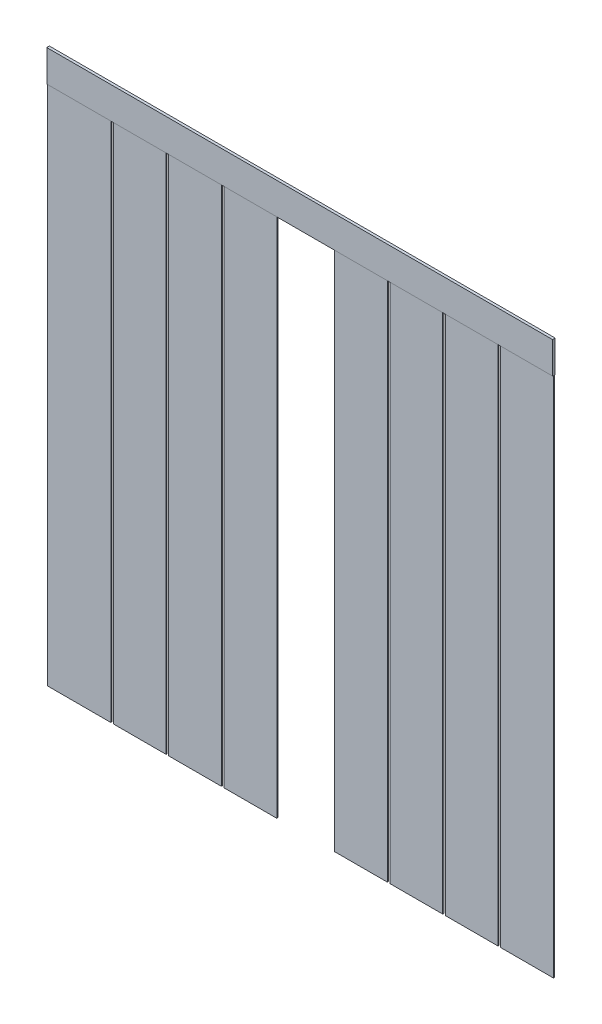
from build123d import *

# Parameters (mm, degrees)
CROQUIS1_W              = 1920
CROQUIS1_H              = 2100
SALIENTE_EXTRUIR1_DEPTH = 10
CROQUIS2_W              = 1920
CROQUIS2_H              = 1980
CORTAR_EXTRUIR1_DEPTH   = 3
CROQUIS3_W              = 1920
CROQUIS3_H              = 1980
CORTAR_EXTRUIR2_DEPTH   = 3
CROQUIS4_W              = 10
CROQUIS4_H              = 1980
CORTAR_EXTRUIR3_DEPTH   = 8
MATRIZL1_COUNT          = 8
MATRIZL1_PITCH          = 210
CROQUIS5_W              = 200
CROQUIS5_H              = 1980
CORTAR_EXTRUIR4_DEPTH   = 10


with BuildPart() as part:
    # Croquis1 → Saliente-Extruir1 (new body)
    with BuildSketch(Plane.XY):
        with Locations((960, -1050)):
            Rectangle(CROQUIS1_W, CROQUIS1_H)
    extrude(amount=SALIENTE_EXTRUIR1_DEPTH)

    # Croquis2 → Cortar-Extruir1 (cut)
    with BuildSketch(Plane.XY.offset(10)):
        with Locations((960, -1110)):
            Rectangle(CROQUIS2_W, CROQUIS2_H)
    extrude(amount=-CORTAR_EXTRUIR1_DEPTH, mode=Mode.SUBTRACT)

    # Croquis3 → Cortar-Extruir2 (cut)
    with BuildSketch(Plane(origin=(0, 0, 0), x_dir=(-1, 0, 0), z_dir=(0, 0, -1))):
        with Locations((-960, -1110)):
            Rectangle(CROQUIS3_W, CROQUIS3_H)
    extrude(amount=-CORTAR_EXTRUIR2_DEPTH, mode=Mode.SUBTRACT)

    # Croquis4 → Cortar-Extruir3 (cut)
    with BuildSketch(Plane(origin=(0, 0, 3), x_dir=(-1, 0, 0), z_dir=(0, 0, -1))):
        with Locations((-1715, -1110)):
            Rectangle(CROQUIS4_W, CROQUIS4_H)
    cortar_extruir3 = extrude(amount=-CORTAR_EXTRUIR3_DEPTH, mode=Mode.SUBTRACT)

    # MatrizL1: Cortar-Extruir3 ×8
    with Locations(*[(-i * MATRIZL1_PITCH, 0, 0) for i in range(1, MATRIZL1_COUNT)]):
        add(cortar_extruir3, mode=Mode.SUBTRACT)

    # Croquis5 → Cortar-Extruir4 (cut)
    with BuildSketch(Plane(origin=(0, 0, 3), x_dir=(-1, 0, 0), z_dir=(0, 0, -1))):
        with Locations((-980, -1110)):
            Rectangle(CROQUIS5_W, CROQUIS5_H)
    extrude(amount=-CORTAR_EXTRUIR4_DEPTH, mode=Mode.SUBTRACT)


solid = part.part
